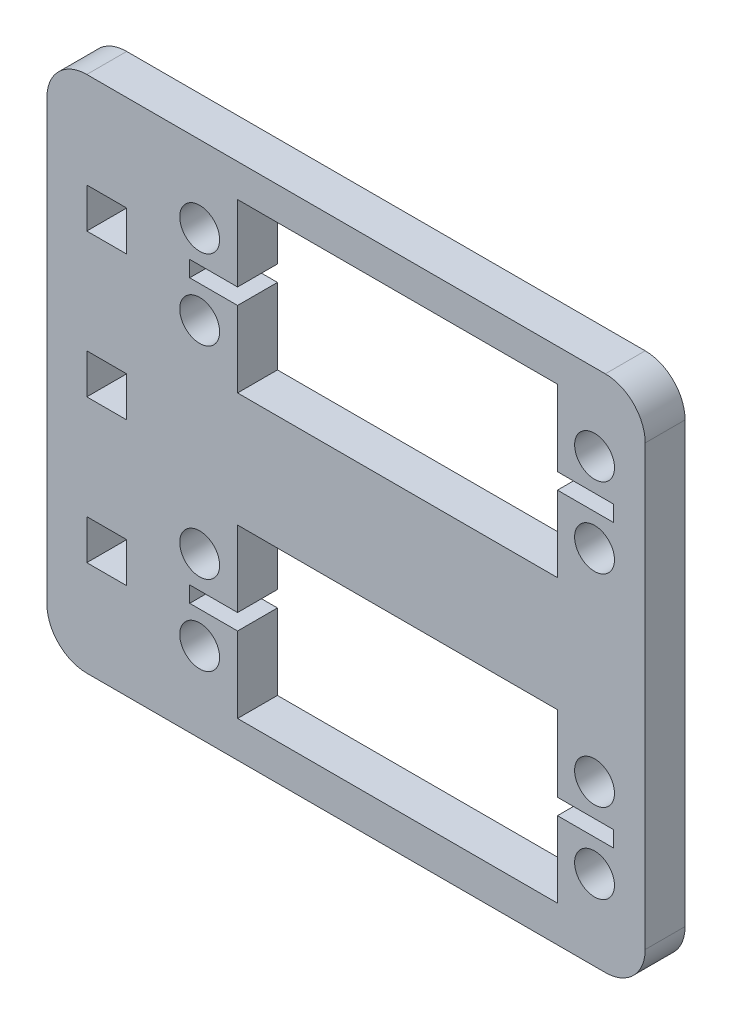
from build123d import *

# Parameters (mm, degrees)
SKETCH_4_R          = 2.5
EXTRUDE_1_DEPTH     = 5
SKETCH_5_W          = 5
SKETCH_5_H          = 5
CUT_EXTRUDE_5_DEPTH = 5
FILLET_1_R          = 5


with BuildPart() as part:
    # 草图4 → 凸台-拉伸1 (new body)
    with BuildSketch(Plane.XY):
        Polygon((-30.514243596, -31.085830111), (29.485756404, -31.085830111), (29.485756404, 33.914169889), (-30.514243596, 33.914169889), (-45.514243596, 33.914169889), (-45.514243596, -31.085830111), align=None)
        with Locations((23.135756404, 24.289169889)):
            Circle(SKETCH_4_R, mode=Mode.SUBTRACT)
        with Locations((23.135756404, 14.289169889)):
            Circle(SKETCH_4_R, mode=Mode.SUBTRACT)
        with Locations((23.135756404, -11.050830111)):
            Circle(SKETCH_4_R, mode=Mode.SUBTRACT)
        with Locations((23.135756404, -21.050830111)):
            Circle(SKETCH_4_R, mode=Mode.SUBTRACT)
        with Locations((-26.364243596, -21.050830111)):
            Circle(SKETCH_4_R, mode=Mode.SUBTRACT)
        with Locations((-26.364243596, -11.050830111)):
            Circle(SKETCH_4_R, mode=Mode.SUBTRACT)
        with Locations((-26.364243596, 14.289169889)):
            Circle(SKETCH_4_R, mode=Mode.SUBTRACT)
        with Locations((-26.364243596, 24.289169889)):
            Circle(SKETCH_4_R, mode=Mode.SUBTRACT)
        Polygon((-27.614243596, -17.050830111), (-21.614243596, -17.050830111), (-21.614243596, -26.550830111), (18.485756404, -26.550830111), (18.485756404, -17.050830111), (25.485756404, -17.050830111), (25.485756404, -15.050830111), (18.485756404, -15.050830111), (18.485756404, -5.550830111), (-21.614243596, -5.550830111), (-21.614243596, -15.050830111), (-27.614243596, -15.050830111), align=None, mode=Mode.SUBTRACT)
        Polygon((18.485756404, 29.789169889), (-21.614243596, 29.789169889), (-21.614243596, 20.289169889), (-27.614243596, 20.289169889), (-27.614243596, 18.289169889), (-21.614243596, 18.289169889), (-21.614243596, 8.789169889), (18.485756404, 8.789169889), (18.485756404, 18.289169889), (25.485756404, 18.289169889), (25.485756404, 20.289169889), (18.485756404, 20.289169889), align=None, mode=Mode.SUBTRACT)
    extrude(amount=EXTRUDE_1_DEPTH)

    # 草图5 → 切除-拉伸5 (cut)
    with BuildSketch(Plane(origin=(0, 0, 0), x_dir=(-1, 0, 0), z_dir=(0, 0, -1))):
        Polygon((40.514243596, -1.085830111), (40.514243596, 1.414169889), (40.514243596, 3.914169889), (35.514243596, 3.914169889), (35.514243596, -1.085830111), align=None)
        with Locations((38.014243596, 19.414169889)):
            Rectangle(SKETCH_5_W, SKETCH_5_H)
        with Locations((38.014243596, -16.585830111)):
            Rectangle(SKETCH_5_W, SKETCH_5_H)
    extrude(amount=-CUT_EXTRUDE_5_DEPTH, mode=Mode.SUBTRACT)

    # 圆角1
    fillet_1_edges = [part.edges().sort_by_distance(p)[0] for p in [
        (-45.514243596, -31.085830111, 2.5),
        (-45.514243596, 33.914169889, 2.5),
        (29.485756404, 33.914169889, 2.5),
        (29.485756404, -31.085830111, 2.5),
    ]]
    fillet(fillet_1_edges, radius=FILLET_1_R)


solid = part.part
